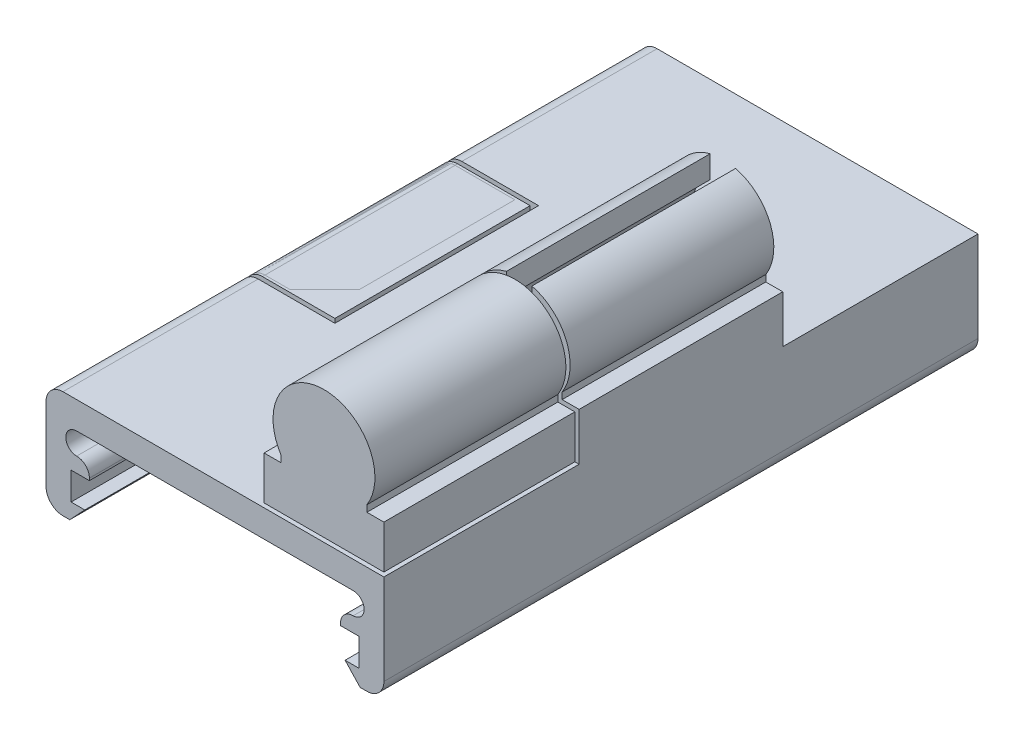
from build123d import *

# Parameters (mm, degrees)
BOSS_EXTRUDE1_DEPTH  = 35
SKETCH2_R            = 1.75
BOSS_EXTRUDE2_DEPTH  = 6
SKETCH3_W            = 6.827847706
SKETCH3_H            = 12
CUT_EXTRUDE1_DEPTH   = 38.650819755
BOSS_EXTRUDE9_DEPTH  = 11.25
BOSS_EXTRUDE5_START  = 11.6
BOSS_EXTRUDE5_DEPTH  = 11.2
SKETCH7_W            = 1
SKETCH7_H            = 12
BOSS_EXTRUDE6_DEPTH  = 2.8
BOSS_EXTRUDE8_DEPTH  = 11.5
SKETCH10_W           = 1.5
SKETCH10_H           = 15.807669909
CUT_EXTRUDE2_DEPTH   = 12
SKETCH11_W           = 7.055900531
SKETCH11_H           = 2.55
BOSS_EXTRUDE10_DEPTH = 11.25


with BuildPart() as part:
    # Sketch1 → Boss-Extrude1 (new body)
    with BuildSketch(Plane.XY):
        with BuildLine():
            Line((-10, 0.77), (-9.193488643, 0.77))
            Line((-9.193488643, 0.77), (-10.078279759, -0.173227408))
            Line((-10.078279759, -0.173227408), (-10.477988856, -0.173227408))
            ThreePointArc((-10.477988856, -0.173227408), (-11.185095638, 0.119665811), (-11.477988856, 0.826772592))
            Line((-11.477988856, 0.826772592), (-11.477988856, 5.16))
            ThreePointArc((-11.477988856, 5.16), (-11.185095638, 5.867106781), (-10.477988856, 6.16))
            Line((-10.477988856, 6.16), (7.42638243, 6.16))
            Line((7.42638243, 6.16), (8.42638243, 6.16))
            Line((8.42638243, 6.16), (8.42638243, 5.16))
            Line((8.42638243, 5.16), (8.42638243, 0.826772592))
            ThreePointArc((8.42638243, 0.826772592), (8.133489211, 0.119665811), (7.42638243, -0.173227408))
            Line((7.42638243, -0.173227408), (7.026673332, -0.173227408))
            Line((7.026673332, -0.173227408), (6.141882217, 0.77))
            Line((6.141882217, 0.77), (6.948393574, 0.77))
            Line((6.948393574, 0.77), (6.948393574, 2.4))
            Line((6.948393574, 2.4), (5.869926753, 2.4))
            Line((5.869926753, 2.4), (5.869926753, 2.527601685))
            ThreePointArc((5.869926753, 2.527601685), (6.089596667, 3.05793177), (6.619926753, 3.277601685))
            ThreePointArc((6.619926753, 3.277601685), (7.261125911, 3.918800842), (6.619926753, 4.56))
            Line((6.619926753, 4.56), (-9.671533179, 4.56))
            ThreePointArc((-9.671533179, 4.56), (-10.312732337, 3.918800842), (-9.671533179, 3.277601685))
            ThreePointArc((-9.671533179, 3.277601685), (-9.141203094, 3.05793177), (-8.921533179, 2.527601685))
            Line((-8.921533179, 2.527601685), (-8.921533179, 2.4))
            Line((-8.921533179, 2.4), (-10, 2.4))
            Line((-10, 2.4), (-10, 0.77))
        make_face()
    extrude(amount=-BOSS_EXTRUDE1_DEPTH)

    # Sketch2 → Boss-Extrude2 (add, symmetric)
    with BuildSketch(Plane(origin=(0, 0, -17.5), x_dir=(-1, 0, 0), z_dir=(0, 0, -1))):
        with BuildLine():
            Line((-7.42638243, 6.16), (-2.370481899, 6.16))
            Line((-2.370481899, 6.16), (-2.370481899, 9.344615385))
            ThreePointArc((-2.370481899, 9.344615385), (-4.898432165, 13.96), (-7.42638243, 9.344615385))
            Line((-7.42638243, 9.344615385), (-7.42638243, 6.16))
        make_face()
        with Locations((-4.898432165, 10.96)):
            Circle(SKETCH2_R, mode=Mode.SUBTRACT)
    extrude(amount=BOSS_EXTRUDE2_DEPTH, both=True)

    # Sketch3 → Cut-Extrude1 (cut, through all)
    with BuildSketch(Plane(origin=(0, 6.16, 0), x_dir=(1, 0, 0), z_dir=(0, 1, 0))):
        with Locations((-9.373923853, 17.5)):
            Rectangle(SKETCH3_W, SKETCH3_H)
    extrude(amount=-CUT_EXTRUDE1_DEPTH, mode=Mode.SUBTRACT)

    # Sketch7 → Boss-Extrude6 (add)
    with BuildSketch(Plane(origin=(0, 6.16, 0), x_dir=(1, 0, 0), z_dir=(0, 1, 0))):
        with Locations((7.92638243, 17.5)):
            Rectangle(SKETCH7_W, SKETCH7_H)
        with Locations((1.870481899, 17.5)):
            Rectangle(SKETCH7_W, SKETCH7_H)
    extrude(amount=BOSS_EXTRUDE6_DEPTH)

    # Sketch10 → Cut-Extrude2 (cut)
    with BuildSketch(Plane.XY.offset(-11.5)):
        with Locations((4.898432165, 14.544608337)):
            Rectangle(SKETCH10_W, SKETCH10_H)
    extrude(amount=-CUT_EXTRUDE2_DEPTH, mode=Mode.SUBTRACT)


with BuildPart() as body_2:
    # Sketch4 → Boss-Extrude9 (new body)
    with BuildSketch(Plane.XY):
        with BuildLine():
            Line((7.42638243, 6.41), (7.42638243, 9.344615385))
            ThreePointArc((7.42638243, 9.344615385), (4.898432165, 13.96), (2.370481899, 9.344615385))
            Line((2.370481899, 9.344615385), (2.370481899, 6.41))
            Line((2.370481899, 6.41), (7.42638243, 6.41))
        make_face()
    extrude(amount=-BOSS_EXTRUDE9_DEPTH)

    # Sketch11 → Boss-Extrude10 (add)
    with BuildSketch(Plane.XY):
        with Locations((4.898432164, 7.685)):
            Rectangle(SKETCH11_W, SKETCH11_H)
    extrude(amount=-BOSS_EXTRUDE10_DEPTH)


with BuildPart() as body_3:
    # Sketch6 → Boss-Extrude5 (new body)
    with BuildSketch(Plane.XY.offset(-23.5).offset(BOSS_EXTRUDE5_START)):
        with BuildLine():
            Line((-6.96, 6.16), (-6.96, 4.56))
            Line((-6.96, 4.56), (-9.671533179, 4.56))
            ThreePointArc((-9.671533179, 4.56), (-10.312732337, 3.918800842), (-9.671533179, 3.277601685))
            ThreePointArc((-9.671533179, 3.277601685), (-9.141203094, 3.05793177), (-8.921533179, 2.527601685))
            Line((-8.921533179, 2.527601685), (-8.921533179, 2.4))
            Line((-8.921533179, 2.4), (-10, 2.4))
            Line((-10, 2.4), (-10, 0.77))
            Line((-10, 0.77), (-9.193488643, 0.77))
            Line((-9.193488643, 0.77), (-10.078279759, -0.173227408))
            Line((-10.078279759, -0.173227408), (-10.477988856, -0.173227408))
            ThreePointArc((-10.477988856, -0.173227408), (-11.185095638, 0.119665811), (-11.477988856, 0.826772592))
            Line((-11.477988856, 0.826772592), (-11.477988856, 5.16))
            ThreePointArc((-11.477988856, 5.16), (-11.185095638, 5.867106781), (-10.477988856, 6.16))
            Line((-10.477988856, 6.16), (-6.96, 6.16))
        make_face()
    extrude(amount=-BOSS_EXTRUDE5_DEPTH)


with BuildPart() as body_4:
    # Sketch9 → Boss-Extrude8 (new body)
    with BuildSketch(Plane.XY.offset(-23.25)):
        with BuildLine():
            Line((-6.21, 6.16), (-10.477988856, 6.16))
            ThreePointArc((-10.477988856, 6.16), (-11.185095638, 5.867106781), (-11.477988856, 5.16))
            Line((-11.477988856, 5.16), (-11.477988856, 0.826772592))
            ThreePointArc((-11.477988856, 0.826772592), (-11.185095638, 0.119665811), (-10.477988856, -0.173227408))
            Line((-10.477988856, -0.173227408), (-10.078279759, -0.173227408))
            Line((-10.078279759, -0.173227408), (-9.193488643, 0.77))
            Line((-9.193488643, 0.77), (-10, 0.77))
            Line((-10, 0.77), (-10, 2.4))
            Line((-10, 2.4), (-8.921533179, 2.4))
            Line((-8.921533179, 2.4), (-8.921533179, 2.527601685))
            ThreePointArc((-8.921533179, 2.527601685), (-9.141203094, 3.05793177), (-9.671533179, 3.277601685))
            ThreePointArc((-9.671533179, 3.277601685), (-10.312732337, 3.918800842), (-9.671533179, 4.56))
            Line((-9.671533179, 4.56), (-6.21, 4.56))
            Line((-6.21, 4.56), (-6.21, 6.16))
        make_face()
    extrude(amount=BOSS_EXTRUDE8_DEPTH)


solid = Compound([part.part, body_2.part, body_3.part, body_4.part])
